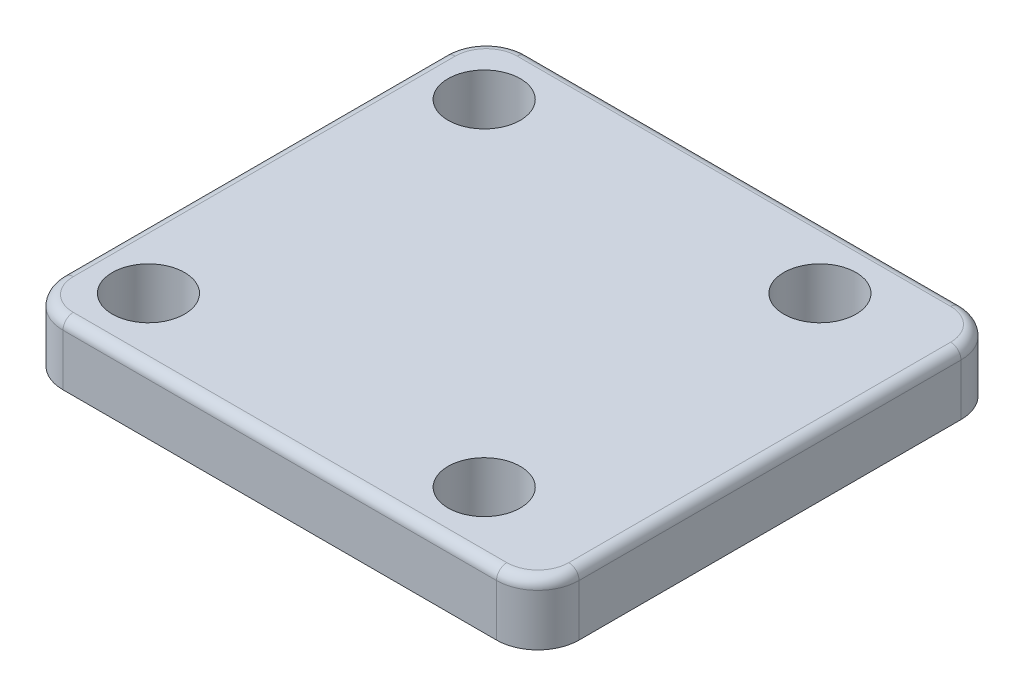
from build123d import *

# Parameters (mm, degrees)
BOSS_EXTRUDE1_DEPTH = 6
FILLET1_R           = 1
SKETCH2_R           = 16
BOSS_EXTRUDE2_DEPTH = 2
CHAMFER1_SIZE       = 1
SKETCH3_R           = 3.5
CUT_EXTRUDE1_DEPTH  = 37.568112016


with BuildPart() as part:
    # Sketch1 → Boss-Extrude1 (new body)
    with BuildSketch(Plane(origin=(0, 0, 0), x_dir=(1, 0, 0), z_dir=(0, 1, 0))):
        with BuildLine():
            Line((-18.30565371, 22.5), (23.69434629, 22.5))
            ThreePointArc((23.69434629, 22.5), (26.522773414, 21.328427125), (27.69434629, 18.5))
            Line((27.69434629, 18.5), (27.69434629, -18.5))
            ThreePointArc((27.69434629, -18.5), (26.522773414, -21.328427125), (23.69434629, -22.5))
            Line((23.69434629, -22.5), (-18.30565371, -22.5))
            ThreePointArc((-18.30565371, -22.5), (-21.134080835, -21.328427125), (-22.30565371, -18.5))
            Line((-22.30565371, -18.5), (-22.30565371, 18.5))
            ThreePointArc((-22.30565371, 18.5), (-21.134080835, 21.328427125), (-18.30565371, 22.5))
        make_face()
    extrude(amount=BOSS_EXTRUDE1_DEPTH)

    # Fillet1
    fillet1_edges = [part.edges().sort_by_distance(p)[0] for p in [
        (-21.134080835, 6, -21.328427125),
        (-22.30565371, 6, 0),
        (-21.134080835, 6, 21.328427125),
        (2.69434629, 6, 22.5),
        (26.522773414, 6, 21.328427125),
        (27.69434629, 6, 0),
        (26.522773414, 6, -21.328427125),
        (2.69434629, 6, -22.5),
    ]]
    fillet(fillet1_edges, radius=FILLET1_R)

    # Sketch2 → Boss-Extrude2 (add)
    with BuildSketch(Plane.XZ):
        with Locations(Location((0, 0, 0), (0, 0, 270))):
            Circle(SKETCH2_R)
    extrude(amount=BOSS_EXTRUDE2_DEPTH)

    # Chamfer1
    chamfer1_edges = [part.edges().sort_by_distance(p)[0] for p in [
        (0, -2, 16),
    ]]
    chamfer(chamfer1_edges, length=CHAMFER1_SIZE)

    # Sketch3 → Cut-Extrude1 (cut, through all)
    with BuildSketch(Plane(origin=(0, 6, 0), x_dir=(1, 0, 0), z_dir=(0, 1, 0))):
        with Locations(Location((-16.263455967, 16.263455967, 0), (0, 0, 270))):
            Circle(SKETCH3_R)
        with Locations(Location((16.263455967, 16.263455967, 0), (0, 0, 270))):
            Circle(SKETCH3_R)
        with Locations(Location((16.263455967, -16.263455967, 0), (0, 0, 270))):
            Circle(SKETCH3_R)
        with Locations(Location((-16.263455967, -16.263455967, 0), (0, 0, 270))):
            Circle(SKETCH3_R)
    extrude(amount=-CUT_EXTRUDE1_DEPTH, mode=Mode.SUBTRACT)


solid = part.part
